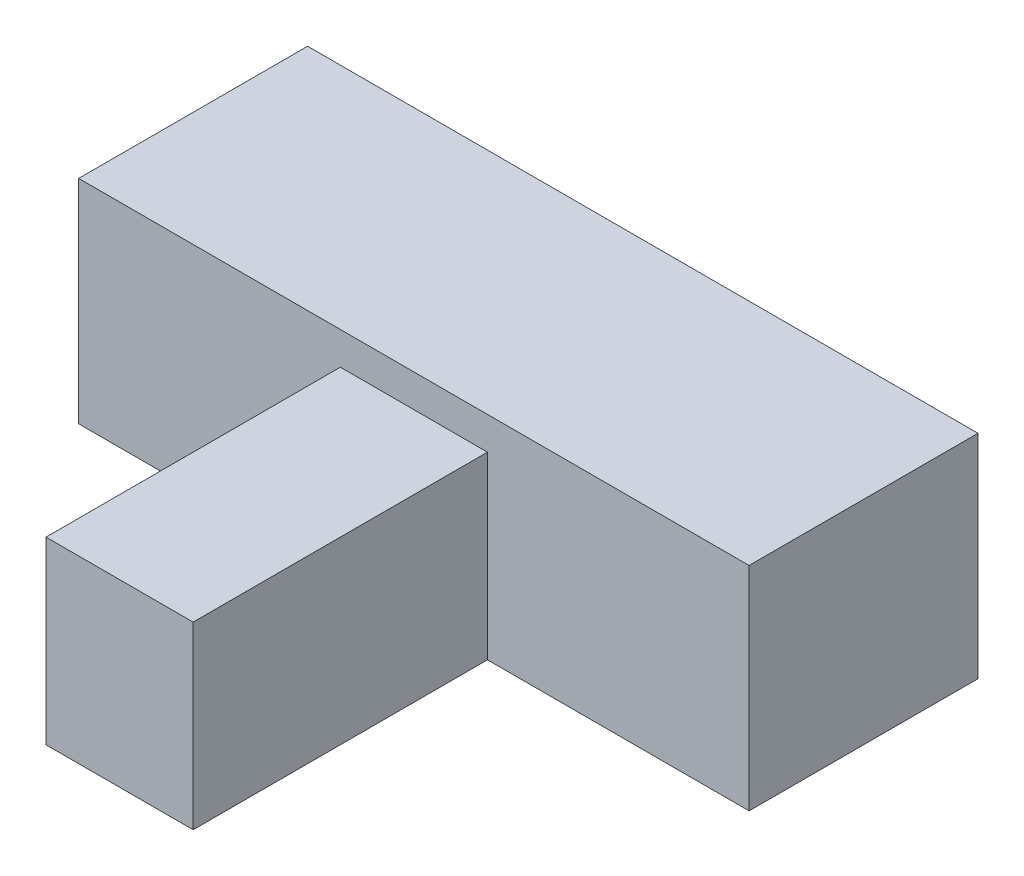
from build123d import *

# Parameters (mm, degrees)
SKETCH1_W           = 45
SKETCH1_H           = 55
BOSS_EXTRUDE1_DEPTH = 165
BOSS_EXTRUDE2_DEPTH = 75
SKETCH3_W           = 205
SKETCH3_H           = 80
CUT_EXTRUDE1_DEPTH  = 5
SKETCH4_W           = 205
SKETCH4_H           = 70
CUT_EXTRUDE2_DEPTH  = 15


with BuildPart() as part:
    # Sketch1 → Boss-Extrude1 (new body)
    with BuildSketch(Plane.XY):
        with Locations((22.5, 27.5)):
            Rectangle(SKETCH1_W, SKETCH1_H)
    extrude(amount=BOSS_EXTRUDE1_DEPTH)

    # Sketch2 → Boss-Extrude2 (add)
    with BuildSketch(Plane(origin=(0, 0, 0), x_dir=(-1, 0, 0), z_dir=(0, 0, -1))):
        Polygon((0, 0), (80, 0), (80, 80), (-125, 80), (-125, 0), (-45, 0), align=None)
    extrude(amount=-BOSS_EXTRUDE2_DEPTH)

    # Sketch3 → Cut-Extrude1 (cut)
    with BuildSketch(Plane(origin=(0, 0, 0), x_dir=(-1, 0, 0), z_dir=(0, 0, -1))):
        with Locations((-22.5, 40)):
            Rectangle(SKETCH3_W, SKETCH3_H)
    extrude(amount=-CUT_EXTRUDE1_DEPTH, mode=Mode.SUBTRACT)

    # Sketch4 → Cut-Extrude2 (cut)
    with BuildSketch(Plane(origin=(0, 80, 0), x_dir=(1, 0, 0), z_dir=(0, 1, 0))):
        with Locations((22.5, -40)):
            Rectangle(SKETCH4_W, SKETCH4_H)
    extrude(amount=-CUT_EXTRUDE2_DEPTH, mode=Mode.SUBTRACT)


solid = part.part
